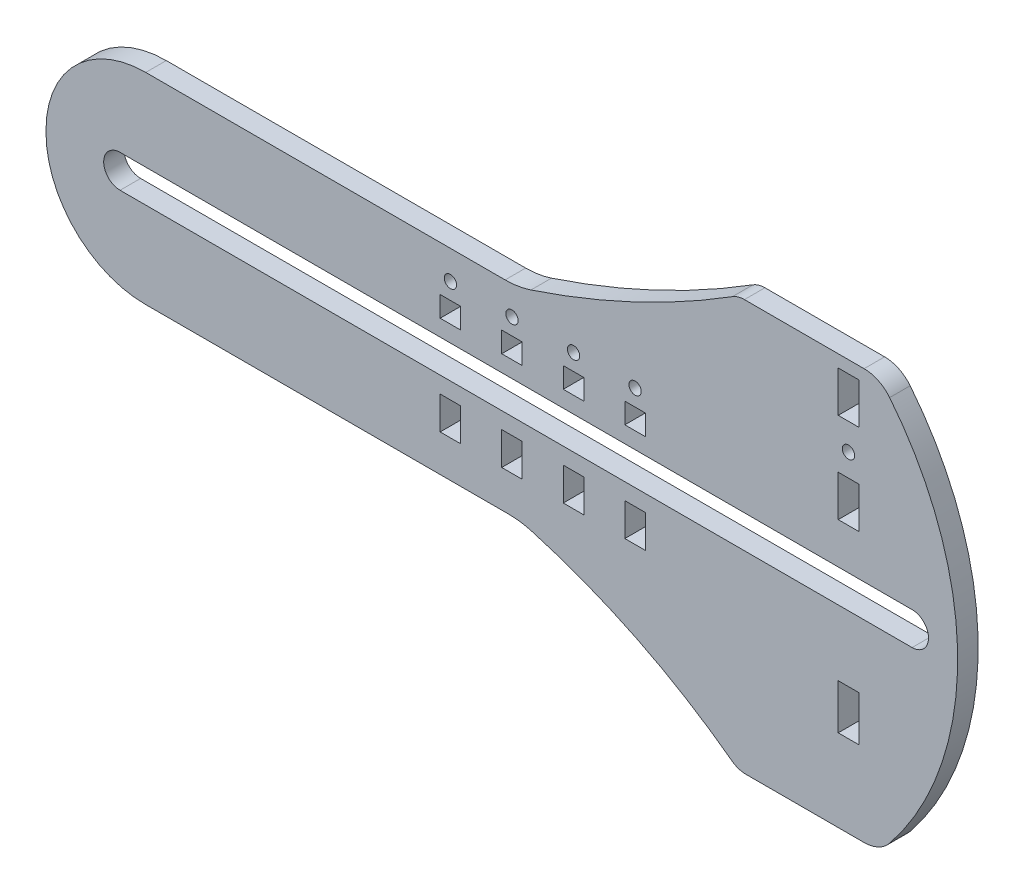
from build123d import *

# Parameters (mm, degrees)
MODEL_R                  = 1.500000022
MODEL_W                  = 5.000000119
MODEL_H                  = 5.000000119
MODEL_H_2                = 8.000000119
MODEL_H_3                = 11.000000119
MODEL_H_4                = 10
RESSALTO_EXTRUS_O1_DEPTH = 5


with BuildPart() as part:
    # Model → Ressalto-extrusão1 (new body)
    with BuildSketch(Plane.XY):
        with BuildLine():
            Line((-180.698726154, 44.000000686), (-209.539314988, 44.000000686))
            ThreePointArc((-209.539314988, 44.000000686), (-211.26607554, 44.278095095), (-212.818217016, 45.084255959))
            ThreePointArc((-212.818217016, 45.084255959), (-236.218705268, 59.378884867), (-261.807031602, 69.235700855))
            ThreePointArc((-261.807031602, 69.235700855), (-264.518550223, 69.808004431), (-267.283148189, 70.000001046))
            Line((-267.283148189, 70.000001046), (-355.903623858, 70.000001046))
            ThreePointArc((-355.903623858, 70.000001046), (-372.979904567, 77.073228111), (-380.053131631, 94.149508819))
            Line((-380.053131631, 94.149508819), (-380.053131631, 94.691449457))
            ThreePointArc((-380.053131631, 94.691449457), (-372.93332153, 111.880191563), (-355.744579423, 119.000001664))
            Line((-355.744579423, 119.000001664), (-268.169073012, 119.000001664))
            ThreePointArc((-268.169073012, 119.000001664), (-264.984221388, 119.255211968), (-261.880650458, 120.014329651))
            ThreePointArc((-261.880650458, 120.014329651), (-236.634658237, 130.102883651), (-212.786381277, 143.156570145))
            ThreePointArc((-212.786381277, 143.156570145), (-211.382514446, 143.784939438), (-209.859544299, 144.000002169))
            Line((-209.859544299, 144.000002169), (-180.698726151, 144.000002169))
            ThreePointArc((-180.698726151, 144.000002169), (-177.244327452, 143.215757822), (-174.467201918, 141.016784577))
            ThreePointArc((-174.467201918, 141.016784577), (-157.893223845, 94.000001427), (-174.467201921, 46.983218277))
            ThreePointArc((-174.467201921, 46.983218277), (-177.244327455, 44.784245034), (-180.698726154, 44.000000686))
        make_face()
        with Locations((-281.500004195, 112.000001669)):
            Circle(MODEL_R, mode=Mode.SUBTRACT)
        with Locations((-184.500002749, 124.500001855)):
            Circle(MODEL_R, mode=Mode.SUBTRACT)
        with Locations((-251.500003748, 112.000001669)):
            Circle(MODEL_R, mode=Mode.SUBTRACT)
        with Locations((-236.500003524, 112.000001669)):
            Circle(MODEL_R, mode=Mode.SUBTRACT)
        with Locations((-266.500003971, 112.000001669)):
            Circle(MODEL_R, mode=Mode.SUBTRACT)
        with Locations((-281.499999941, 105.500001595)):
            Rectangle(MODEL_W, MODEL_H, mode=Mode.SUBTRACT)
        with Locations((-281.499999941, 83.000001236)):
            Rectangle(MODEL_W, MODEL_H_2, mode=Mode.SUBTRACT)
        with Locations((-236.50000006, 105.500001595)):
            Rectangle(MODEL_W, MODEL_H, mode=Mode.SUBTRACT)
        with Locations((-236.50000006, 83.000001236)):
            Rectangle(MODEL_W, MODEL_H_2, mode=Mode.SUBTRACT)
        with Locations((-251.499999941, 83.000001236)):
            Rectangle(MODEL_W, MODEL_H_2, mode=Mode.SUBTRACT)
        with Locations((-251.499999941, 105.500001595)):
            Rectangle(MODEL_W, MODEL_H, mode=Mode.SUBTRACT)
        with Locations((-184.499999941, 69.500001367)):
            Rectangle(MODEL_W, MODEL_H_3, mode=Mode.SUBTRACT)
        with Locations((-184.499999941, 136.000001903)):
            Rectangle(MODEL_W, MODEL_H_4, mode=Mode.SUBTRACT)
        with Locations((-184.499999941, 114.000001664)):
            Rectangle(MODEL_W, MODEL_H_4, mode=Mode.SUBTRACT)
        with Locations((-266.499999941, 83.000001236)):
            Rectangle(MODEL_W, MODEL_H_2, mode=Mode.SUBTRACT)
        with Locations((-266.499999941, 105.500001595)):
            Rectangle(MODEL_W, MODEL_H, mode=Mode.SUBTRACT)
        with BuildLine():
            Line((-362.000002593, 91.000001416), (-169.000002593, 91.000001416))
            ThreePointArc((-169.000002593, 91.000001416), (-165.000002841, 95.000001167), (-169.000002593, 99.000000919))
            Line((-169.000002593, 99.000000919), (-362.000002593, 99.000000919))
            ThreePointArc((-362.000002593, 99.000000919), (-366.000002344, 95.000001167), (-362.000002593, 91.000001416))
        make_face(mode=Mode.SUBTRACT)
    extrude(amount=RESSALTO_EXTRUS_O1_DEPTH)


solid = part.part
